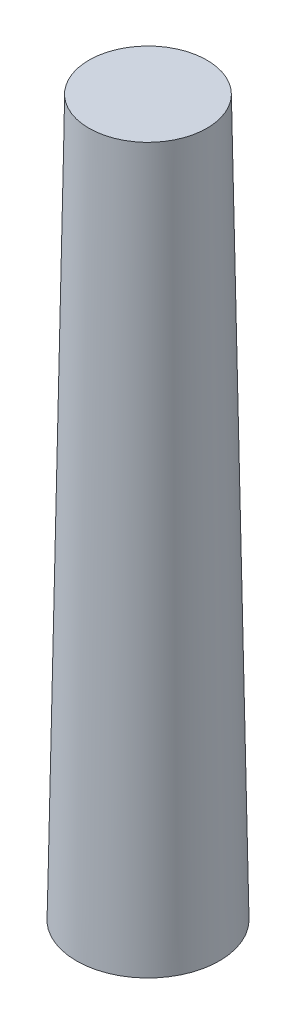
from build123d import *

# Parameters (mm, degrees)
SKETCH1_R           = 1
BOSS_EXTRUDE1_DEPTH = 10
BOSS_EXTRUDE1_TAPER = 1


with BuildPart() as part:
    # Sketch1 → Boss-Extrude1 (new body)
    with BuildSketch(Plane(origin=(0, 0, 0), x_dir=(1, 0, 0), z_dir=(0, 1, 0))):
        Circle(SKETCH1_R)
    extrude(amount=BOSS_EXTRUDE1_DEPTH, taper=BOSS_EXTRUDE1_TAPER)


solid = part.part
